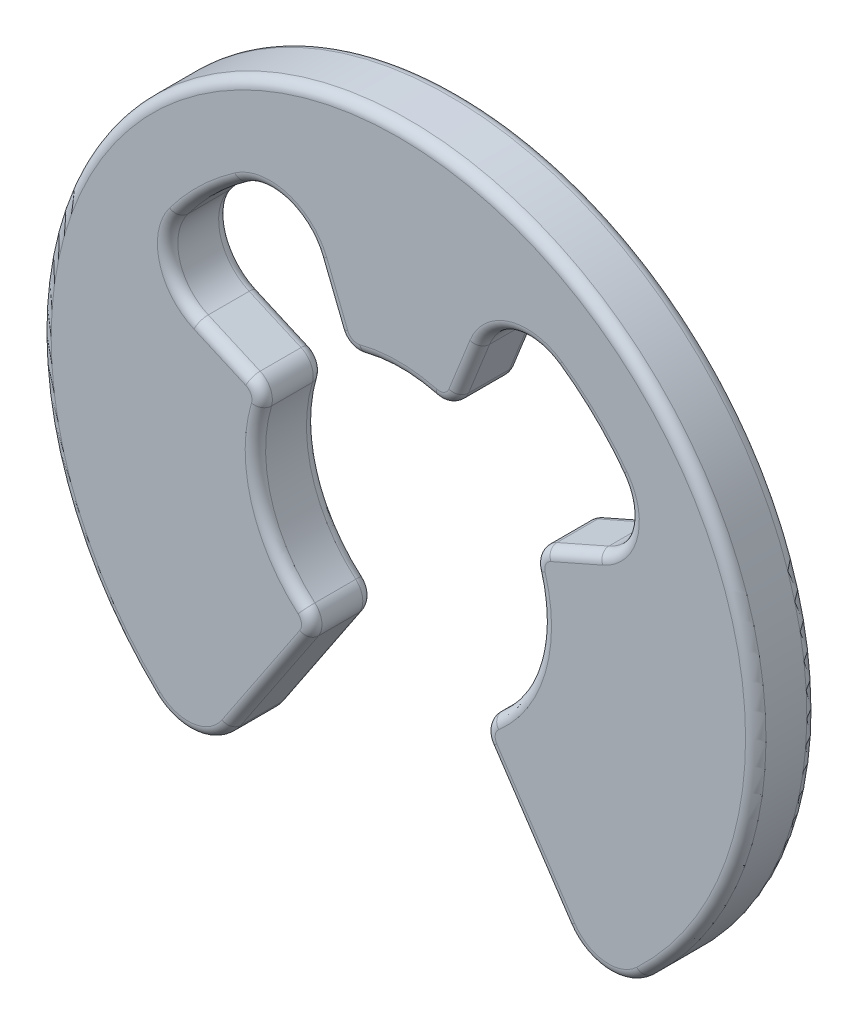
from build123d import *

# Parameters (mm, degrees)
EXTRUDE_1_DEPTH = 0.6
FILLET_1_R      = 0.2
FILLET_2_R      = 0.5
FILLET_3_R      = 0.1


with BuildPart() as part:
    # 草图1 → 凸台-拉伸1 (new body)
    with BuildSketch(Plane.XY):
        with BuildLine():
            Line((-0.518518519, 1.300437829), (-1, 2.507987241))
            ThreePointArc((-1, 2.507987241), (-1.875399156, 1.942389767), (-2.471360189, 1.087372438))
            Line((-2.471360189, 1.087372438), (-1.281446024, 0.563822745))
            ThreePointArc((-1.281446024, 0.563822745), (-1.34406288, -0.391784346), (-0.777777778, -1.164071187))
            Line((-0.777777778, -1.164071187), (-1.944444444, -2.910177967))
            ThreePointArc((-1.944444444, -2.910177967), (0, 3.5), (1.944444444, -2.910177967))
            Line((1.944444444, -2.910177967), (0.777777778, -1.164071187))
            ThreePointArc((0.777777778, -1.164071187), (1.34406288, -0.391784346), (1.281446024, 0.563822745))
            Line((1.281446024, 0.563822745), (2.471360189, 1.087372438))
            ThreePointArc((2.471360189, 1.087372438), (1.875399156, 1.942389767), (1, 2.507987241))
            Line((1, 2.507987241), (0.518518519, 1.300437829))
            ThreePointArc((0.518518519, 1.300437829), (0, 1.4), (-0.518518519, 1.300437829))
        make_face()
    extrude(amount=EXTRUDE_1_DEPTH)

    # 圆角1
    fillet_1_edges = [part.edges().sort_by_distance(p)[0] for p in [
        (0.518518519, 1.300437829, 0.3),
        (-0.518518519, 1.300437829, 0.3),
        (-1.281446024, 0.563822745, 0.3),
        (-0.777777778, -1.164071187, 0.3),
        (0.777777778, -1.164071187, 0.3),
        (1.281446024, 0.563822745, 0.3),
    ]]
    fillet(fillet_1_edges, radius=FILLET_1_R)

    # 圆角2
    fillet_2_edges = [part.edges().sort_by_distance(p)[0] for p in [
        (1, 2.507987241, 0.3),
        (-1, 2.507987241, 0.3),
        (-2.471360189, 1.087372438, 0.3),
        (-1.944444444, -2.910177967, 0.3),
        (1.944444444, -2.910177967, 0.3),
        (2.471360189, 1.087372438, 0.3),
    ]]
    fillet(fillet_2_edges, radius=FILLET_2_R)

    # 圆角3
    fillet_3_edges = [part.edges().sort_by_distance(p)[0] for p in [
        (1.262636299, -1.889740975, 0),
        (1.262636299, -1.889740975, 0.6),
        (0.690718392, 1.732312913, 0),
        (0, 1.4, 0),
        (-1.707013935, 0.751068141, 0),
        (-1.34406288, -0.391784346, 0),
        (1.34406288, -0.391784346, 0),
        (-0.849997983, -1.182160492, 0),
        (-1.352074472, 0.540272729, 0),
        (-0.492505133, 1.37019659, 0),
        (0.492505133, 1.37019659, 0),
        (1.352074472, 0.540272729, 0),
        (0.849997983, -1.182160492, 0),
        (1.34406288, -0.391784346, 0.6),
        (-1.34406288, -0.391784346, 0.6),
        (-1.707013935, 0.751068141, 0.6),
        (0, 1.4, 0.6),
        (0.690718392, 1.732312913, 0.6),
        (-0.849997983, -1.182160492, 0.6),
        (-1.352074472, 0.540272729, 0.6),
        (-0.492505133, 1.37019659, 0.6),
        (0.492505133, 1.37019659, 0.6),
        (1.352074472, 0.540272729, 0.6),
        (0.849997983, -1.182160492, 0.6),
        (0, 3.5, 0),
        (0, 3.5, 0.6),
        (1.707013935, 0.751068141, 0),
        (1.875399156, 1.942389767, 0),
        (-0.690718392, 1.732312913, 0),
        (-1.875399156, 1.942389767, 0),
        (-1.262636299, -1.889740975, 0),
        (-2.002892658, -2.678602746, 0),
        (2.002892658, -2.678602746, 0),
        (-1.262636299, -1.889740975, 0.6),
        (-1.875399156, 1.942389767, 0.6),
        (-0.690718392, 1.732312913, 0.6),
        (1.875399156, 1.942389767, 0.6),
        (1.707013935, 0.751068141, 0.6),
        (-2.002892658, -2.678602746, 0.6),
        (2.002892658, -2.678602746, 0.6),
        (2.243311484, 1.193747469, 0),
        (2.243311484, 1.193747469, 0.6),
        (1.114310209, 2.283810892, 0),
        (1.114310209, 2.283810892, 0.6),
        (-2.243311484, 1.193747469, 0),
        (-2.243311484, 1.193747469, 0.6),
        (-1.114310209, 2.283810892, 0),
        (-1.114310209, 2.283810892, 0.6),
    ]]
    fillet(fillet_3_edges, radius=FILLET_3_R)


solid = part.part
